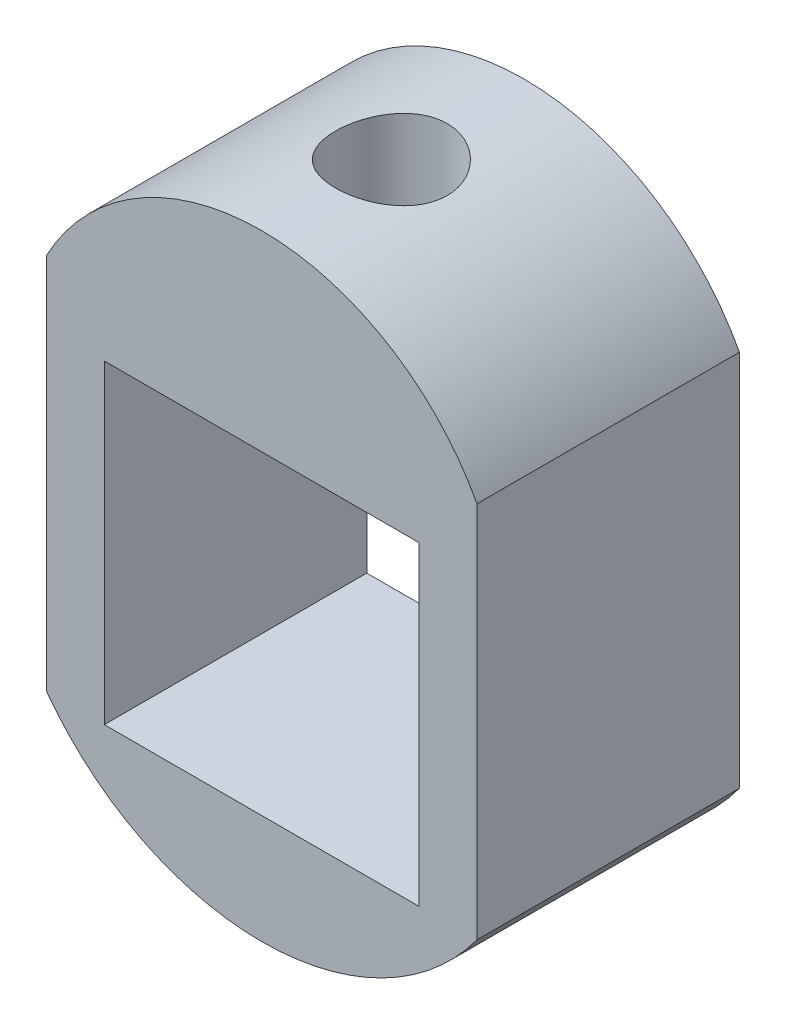
from build123d import *

# Parameters (mm, degrees)
SKETCH3_W           = 7.62
SKETCH3_H           = 7.62
BOSS_EXTRUDE2_DEPTH = 6.35
SKETCH6_R           = 1.35255
CUT_EXTRUDE1_DEPTH  = 3.81
SKETCH7_R           = 1.35255
CUT_EXTRUDE2_DEPTH  = 2.54


with BuildPart() as part:
    # Sketch3 → Boss-Extrude2 (new body)
    with BuildSketch(Plane.XY):
        with BuildLine():
            Line((-5.207, 2.786051193), (-5.207, -6.35))
            ThreePointArc((-5.207, -6.35), (0, -8.992049984), (5.207, -6.35))
            Line((5.207, -6.35), (5.207, 2.786051193))
            ThreePointArc((5.207, 2.786051193), (0, 5.9055), (-5.207, 2.786051193))
        make_face()
        with Locations((0, -2.54)):
            Rectangle(SKETCH3_W, SKETCH3_H, mode=Mode.SUBTRACT)
    extrude(amount=BOSS_EXTRUDE2_DEPTH)

    # Sketch6 → Cut-Extrude1 (cut)
    with BuildSketch(Plane(origin=(0, 5.9055, 0), x_dir=(1, 0, 0), z_dir=(0, 1, 0))):
        with Locations(Location((0, -3.214346547, 0), (0, 0, 180))):
            Circle(SKETCH6_R)
    extrude(amount=-CUT_EXTRUDE1_DEPTH, mode=Mode.SUBTRACT)

    # Sketch7 → Cut-Extrude2 (cut)
    with BuildSketch(Plane(origin=(0, -8.992049984, 0), x_dir=(-1, 0, 0), z_dir=(0, -1, 0))):
        with Locations(Location((0, -3.175, 0), (0, 0, 180))):
            Circle(SKETCH7_R)
    extrude(amount=-CUT_EXTRUDE2_DEPTH, mode=Mode.SUBTRACT)


solid = part.part
